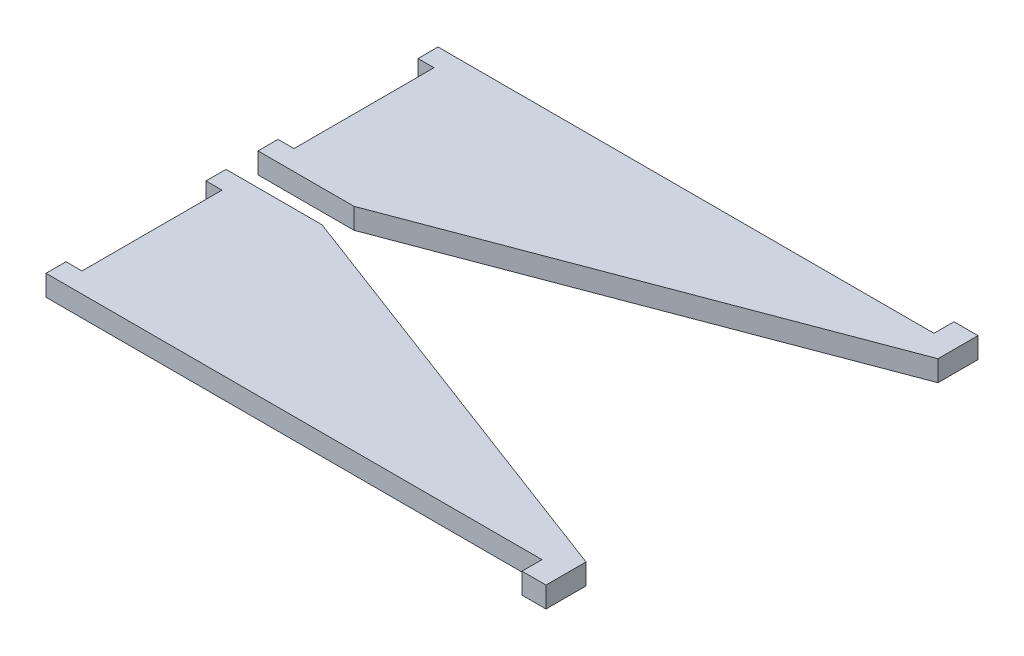
from build123d import *

# Parameters (mm, degrees)
BOSS_EXTRUDE1_DEPTH   = 6.604
BOSS_EXTRUDE1_2_DEPTH = 6.604


with BuildPart() as part:
    # Sketch1 → Boss-Extrude1 (new body)
    with BuildSketch(Plane(origin=(0, 0, 0), x_dir=(1, 0, 0), z_dir=(0, 1, 0))):
        Polygon((157.48, 0), (157.48, 6.35), (165.1, 6.35), (165.1, -6.35), (30.48, -57.15), (0, -57.15), (0, -50.8), (5.08, -50.8), (5.08, -6.35), (0, -6.35), (0, 0), align=None)
    extrude(amount=BOSS_EXTRUDE1_DEPTH)


with BuildPart() as body_2:
    # Sketch1 → Boss-Extrude1 2 (new body)
    with BuildSketch(Plane(origin=(0, 0, 0), x_dir=(1, 0, 0), z_dir=(0, 1, 0))):
        Polygon((0, -73.66), (5.08, -73.66), (5.08, -118.11), (0, -118.11), (0, -124.46), (157.48, -124.46), (157.48, -130.81), (165.1, -130.81), (165.1, -118.11), (30.48, -67.31), (0, -67.31), align=None)
    extrude(amount=BOSS_EXTRUDE1_2_DEPTH)


solid = Compound([part.part, body_2.part])
